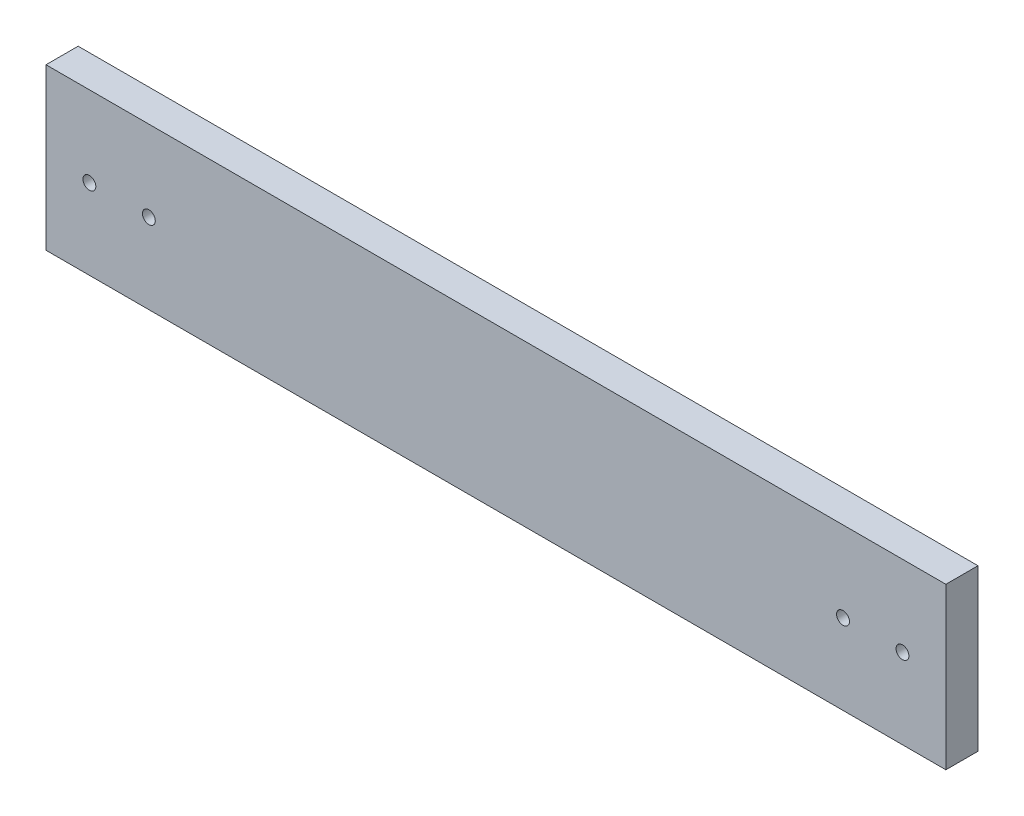
from build123d import *

# Parameters (mm, degrees)
SCHIZZO1_W                   = 280
SCHIZZO1_H                   = 50
ESTRUSIONE_ESTRUSIONE1_DEPTH = 10
SCHIZZO2_R                   = 2
TAGLIO_ESTRUSIONE1_DEPTH     = 10


with BuildPart() as part:
    # Schizzo1 → Estrusione-Estrusione1 (new body)
    with BuildSketch(Plane.XY):
        with Locations((-140, 25)):
            Rectangle(SCHIZZO1_W, SCHIZZO1_H)
    extrude(amount=ESTRUSIONE_ESTRUSIONE1_DEPTH)

    # Schizzo2 → Taglio-Estrusione1 (cut)
    with BuildSketch(Plane(origin=(0, 0, 0), x_dir=(-1, 0, 0), z_dir=(0, 0, -1))):
        with Locations((248, 24.933694222)):
            Circle(SCHIZZO2_R)
        with Locations((266.5, 24.933694222)):
            Circle(SCHIZZO2_R)
        with Locations((13.5, 24.933694222)):
            Circle(SCHIZZO2_R)
        with Locations((32, 24.933694222)):
            Circle(SCHIZZO2_R)
    extrude(amount=-TAGLIO_ESTRUSIONE1_DEPTH, mode=Mode.SUBTRACT)


solid = part.part
